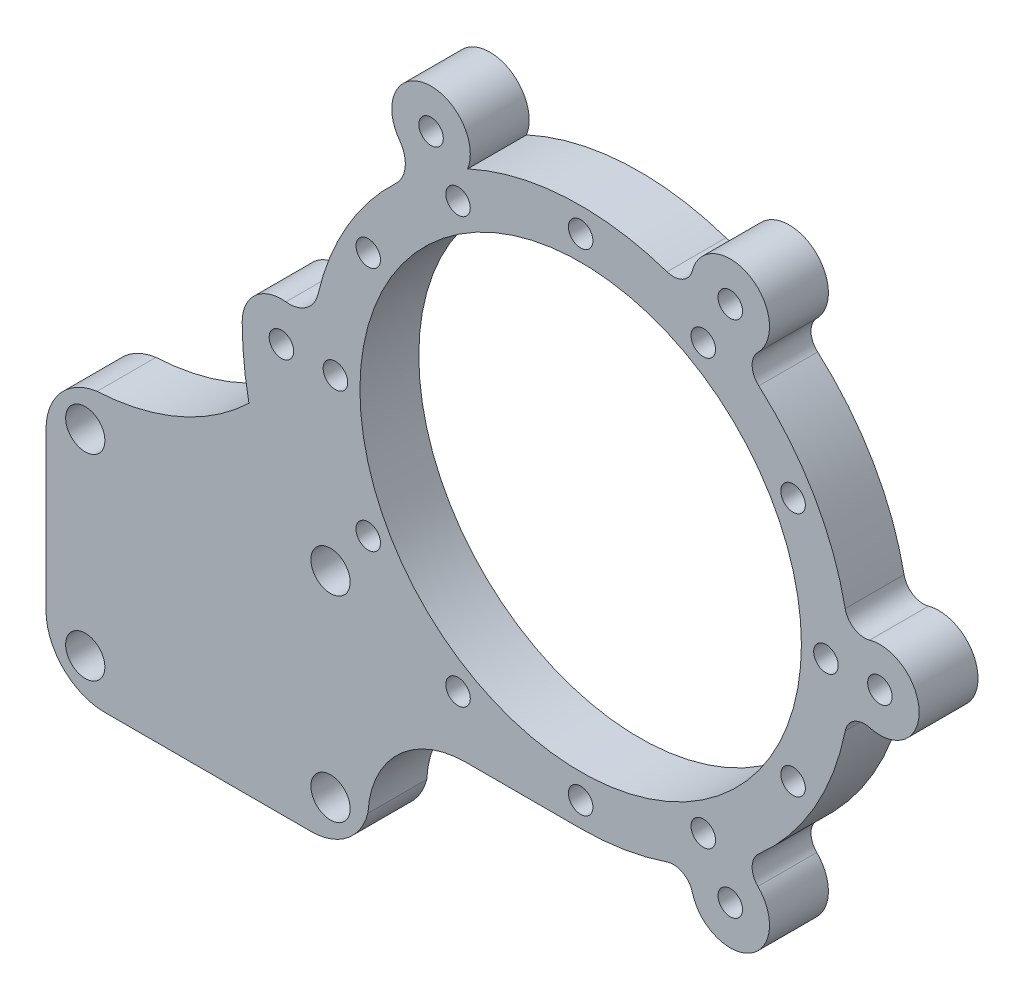
from build123d import *

# Parameters (mm, degrees)
SKETCH_2_R      = 1.25
SKETCH_2_R_2    = 22.5
SKETCH_2_R_3    = 2
EXTRUDE_1_DEPTH = 6
EXTRUDE_START   = -6
SKETCH_3_R      = 1.25
EXTRUDE_2_DEPTH = 6


with BuildPart() as part:
    # 草图2 → 凸台-拉伸1 (new body)
    with BuildSketch(Plane.XY):
        with BuildLine():
            ThreePointArc((11.071751856, 33.094337161), (3.155908846, 19.70243628), (-11.296671761, 13.946874314))
            ThreePointArc((-11.296671761, 13.946874314), (-15.015530454, 11.950947319), (-16.5, 8))
            Line((-16.5, 8), (-16.5, -8))
            ThreePointArc((-16.5, -8), (-14.742640687, -12.242640687), (-10.5, -14))
            Line((-10.5, -14), (10.5, -14))
            ThreePointArc((10.5, -14), (14.176185773, -12.741904487), (16.31070727, -9.495219388))
            ThreePointArc((16.31070727, -9.495219388), (19.407668924, -2.752662347), (26.297958971, 0))
            Line((26.297958971, 0), (37.996710384, 0))
            ThreePointArc((37.996710384, 0), (59.328544247, 44.855197033), (11.071751856, 33.094337161))
        make_face()
        with Locations((16.346075289, 15)):
            Circle(SKETCH_2_R, mode=Mode.SUBTRACT)
        with Locations((37.996710384, 2.5)):
            Circle(SKETCH_2_R, mode=Mode.SUBTRACT)
        with Locations((25.496710384, 5.849364905)):
            Circle(SKETCH_2_R, mode=Mode.SUBTRACT)
        with Locations((50.496710384, 5.849364905)):
            Circle(SKETCH_2_R, mode=Mode.SUBTRACT)
        with Locations((59.647345479, 15)):
            Circle(SKETCH_2_R, mode=Mode.SUBTRACT)
        with Locations((12.996710384, 27.5)):
            Circle(SKETCH_2_R, mode=Mode.SUBTRACT)
        with Locations((16.346075289, 40)):
            Circle(SKETCH_2_R, mode=Mode.SUBTRACT)
        with Locations((37.996710384, 27.5)):
            Circle(SKETCH_2_R_2, mode=Mode.SUBTRACT)
        with Locations((62.996710384, 27.5)):
            Circle(SKETCH_2_R, mode=Mode.SUBTRACT)
        with Locations((25.496710384, 49.150635095)):
            Circle(SKETCH_2_R, mode=Mode.SUBTRACT)
        with Locations((37.996710384, 52.5)):
            Circle(SKETCH_2_R, mode=Mode.SUBTRACT)
        with Locations((59.647345479, 40)):
            Circle(SKETCH_2_R, mode=Mode.SUBTRACT)
        with Locations((50.496710384, 49.150635095)):
            Circle(SKETCH_2_R, mode=Mode.SUBTRACT)
        with Locations((12.5, -10)):
            Circle(SKETCH_2_R_3, mode=Mode.SUBTRACT)
        with Locations((-12.5, 10)):
            Circle(SKETCH_2_R_3, mode=Mode.SUBTRACT)
        with Locations((12.5, 10)):
            Circle(SKETCH_2_R_3, mode=Mode.SUBTRACT)
        with Locations((-12.5, -10)):
            Circle(SKETCH_2_R_3, mode=Mode.SUBTRACT)
    extrude(amount=EXTRUDE_1_DEPTH)

    # 草图3 → 凸台-拉伸2 (add)
    # profile 1 of 5: a face of its own
    with BuildSketch(Plane.XY.offset(6).offset(EXTRUDE_START)):
        with BuildLine():
            ThreePointArc((67.447530056, 23.64004914), (72.496710384, 27.5), (67.447530056, 31.35995086))
            ThreePointArc((67.447530056, 31.35995086), (65.870885098, 31.588991044), (64.961839586, 32.897388914))
            ThreePointArc((64.961839586, 32.897388914), (65.496710384, 27.5), (64.961839586, 22.102611086))
            ThreePointArc((64.961839586, 22.102611086), (65.870885098, 23.411008956), (67.447530056, 23.64004914))
        make_face()
        with Locations((68.496710384, 27.5)):
            Circle(SKETCH_3_R, mode=Mode.SUBTRACT)
    # profile 2 of 5: a face of its own
    with BuildSketch(Plane.XY.offset(6).offset(EXTRUDE_START)):
        with BuildLine():
            ThreePointArc((56.064935722, 51.075182568), (55.246710384, 57.377876431), (49.379304718, 54.935133428))
            ThreePointArc((49.379304718, 54.935133428), (48.392627621, 53.684238934), (46.804999072, 53.551181363))
            ThreePointArc((46.804999072, 53.551181363), (51.746710384, 51.315698604), (56.153550899, 48.153792449))
            ThreePointArc((56.153550899, 48.153792449), (55.474967861, 49.59524789), (56.064935722, 51.075182568))
        make_face()
        with Locations((53.246710384, 53.913774815)):
            Circle(SKETCH_3_R, mode=Mode.SUBTRACT)
    # profile 3 of 5: a face of its own
    with BuildSketch(Plane.XY.offset(6).offset(EXTRUDE_START)):
        with BuildLine():
            ThreePointArc((49.379304718, 0.064866572), (55.246710384, -2.377876431), (56.064935722, 3.924817432))
            ThreePointArc((56.064935722, 3.924817432), (55.474967861, 5.40475211), (56.153550899, 6.846207551))
            ThreePointArc((56.153550899, 6.846207551), (51.746710384, 3.684301396), (46.804999072, 1.448818637))
            ThreePointArc((46.804999072, 1.448818637), (48.392627621, 1.315761066), (49.379304718, 0.064866572))
        make_face()
        with Locations((53.246710384, 1.086225185)):
            Circle(SKETCH_3_R, mode=Mode.SUBTRACT)
    # profile 4 of 5: a face of its own
    with BuildSketch(Plane.XY.offset(6).offset(EXTRUDE_START)):
        with BuildLine():
            ThreePointArc((26.477501839, 52.471140032), (22.209078662, 57.87747916), (19.535000313, 51.529468119))
            ThreePointArc((19.535000313, 51.529468119), (20.114268508, 49.473728128), (19.179054293, 47.553573727))
            ThreePointArc((19.179054293, 47.553573727), (22.630287457, 50.306206314), (26.477501839, 52.471140032))
        make_face()
        with Locations((22.746710384, 53.913774815)):
            Circle(SKETCH_3_R, mode=Mode.SUBTRACT)
    # profile 5 of 5: a face of its own
    with BuildSketch(Plane.XY.offset(6).offset(EXTRUDE_START)):
        with BuildLine():
            ThreePointArc((4.186169411, 20.637251344), (8.570590949, 26.345313518), (11.071751856, 33.094337161))
            ThreePointArc((11.071751856, 33.094337161), (11.144241114, 33.432528477), (11.220978054, 33.769781351))
            ThreePointArc((11.220978054, 33.769781351), (10.025683209, 31.99978526), (7.955726823, 31.473575708))
            ThreePointArc((7.955726823, 31.473575708), (4.835513826, 30.486307566), (3.496710384, 27.5))
            ThreePointArc((3.496710384, 27.5), (3.669507879, 24.051352697), (4.186169411, 20.637251344))
        make_face()
        with Locations((7.496710384, 27.5)):
            Circle(SKETCH_3_R, mode=Mode.SUBTRACT)
    extrude(amount=EXTRUDE_2_DEPTH)


solid = part.part
